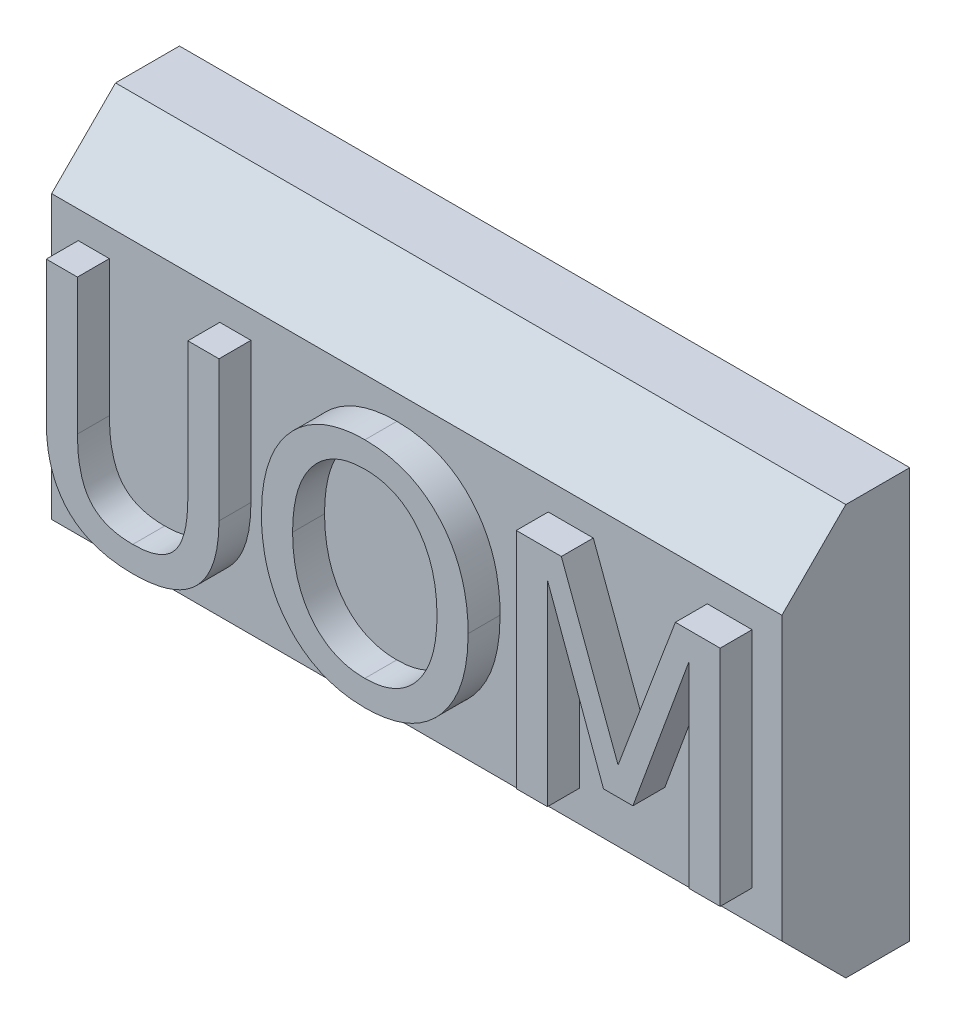
from build123d import *

# Parameters (mm, degrees)
BOSS_EXTRUDE5_DEPTH = 11.427281
BOSS_EXTRUDE6_DEPTH = 0.5


with BuildPart() as part:
    # Sketch6 → Boss-Extrude5 (new body)
    with BuildSketch(Plane(origin=(0, 0, 0), x_dir=(0, 0, -1), z_dir=(1, 0, 0))):
        Polygon((1, 4.929146991), (2, 4.929146991), (2, -1.486632629), (1, -1.486632629), (0, -0.486632629), (0, 3.929146991), align=None)
    extrude(amount=BOSS_EXTRUDE5_DEPTH)

    # Sketch3 → Boss-Extrude6 (add)
    # profile 1 of 3: a face of its own
    with BuildSketch(Plane.XY):
        with BuildLine():
            Line((0.416143204, 3.499962788), (0.903484976, 3.499962788))
            Line((0.903484976, 3.499962788), (0.903484976, 1.371996016))
            add(Edge.make_bspline(
                [(0.903484976, 1.371996016), (0.904227086, 1.326524703), (0.905656325, 1.238950888), (0.914351034, 1.112472094), (0.929908885, 0.995823754), (0.952901435, 0.88903938), (0.980924682, 0.791621238), (1.015086709, 0.703774074), (1.056939832, 0.626271366), (1.104984797, 0.558086727), (1.160610571, 0.498806201), (1.224233651, 0.448193549), (1.295415202, 0.404639357), (1.375404867, 0.37044697), (1.462695851, 0.342558961), (1.558111742, 0.323476327), (1.661242149, 0.312624163), (1.732539226, 0.310954566), (1.769485767, 0.310089371)],
                knots=[0, 0, 0, 0, 1.376819889, 2.651635969, 3.836347594, 4.936722514, 5.955940511, 6.903042086, 7.784610942, 8.616290434, 9.4219432, 10.237023, 11.070988377, 11.94071121, 12.864328567, 13.841290783, 14.88134492, 16, 16, 16, 16], degree=3))
            add(Edge.make_bspline(
                [(1.769485767, 0.310089371), (1.806202381, 0.310952028), (1.877040741, 0.312616375), (1.979473884, 0.323496618), (2.074016457, 0.342434724), (2.160317672, 0.37056602), (2.239557597, 0.404801908), (2.310591352, 0.448180089), (2.374204682, 0.498809996), (2.42983769, 0.558084657), (2.477862395, 0.62627603), (2.519795758, 0.703755997), (2.553648868, 0.791757514), (2.583057817, 0.888807287), (2.604576184, 0.995949131), (2.620568037, 1.112448839), (2.62913327, 1.238957439), (2.630581241, 1.326526942), (2.631333077, 1.371996016)],
                knots=[0, 0, 0, 0, 1.114454679, 2.150147657, 3.122692882, 4.035279244, 4.900768316, 5.736820227, 6.553939311, 7.361607774, 8.195368082, 9.079142573, 10.028613743, 11.052372373, 12.154054081, 13.341729787, 14.619735386, 16, 16, 16, 16], degree=3))
            Line((2.631333077, 1.371996016), (2.631333077, 3.499962788))
            Line((2.631333077, 3.499962788), (3.118674849, 3.499962788))
            Line((3.118674849, 3.499962788), (3.118674849, 1.302771333))
            add(Edge.make_bspline(
                [(3.118674849, 1.302771333), (3.117632966, 1.247119199), (3.115609542, 1.139038072), (3.099395772, 0.982162679), (3.073760625, 0.835658607), (3.03631439, 0.699523534), (2.987830531, 0.574188519), (2.929913308, 0.458712614), (2.859816087, 0.354574755), (2.77943465, 0.260926992), (2.688738665, 0.177698385), (2.587499929, 0.10602186), (2.475912337, 0.045485903), (2.353984334, -0.003248427), (2.222507035, -0.042549241), (2.080438371, -0.068601387), (1.92843276, -0.085798259), (1.82353189, -0.087676906), (1.769485767, -0.088644806)],
                knots=[0, 0, 0, 0, 1.203396059, 2.33709643, 3.407052704, 4.416843994, 5.385341086, 6.309356336, 7.204900642, 8.093184639, 8.972733791, 9.860358641, 10.769263838, 11.711760021, 12.695515199, 13.732034436, 14.831518306, 16, 16, 16, 16], degree=3))
            add(Edge.make_bspline(
                [(1.769485767, -0.088644806), (1.71521014, -0.087673568), (1.609851426, -0.085788222), (1.457142055, -0.068631325), (1.314216014, -0.042395163), (1.181883322, -0.003559879), (1.059492843, 0.045718996), (0.947387007, 0.105755521), (0.846109761, 0.177988639), (0.75466648, 0.26044674), (0.675027309, 0.354825839), (0.605047005, 0.458877246), (0.545964542, 0.573840725), (0.498766704, 0.699718527), (0.460974682, 0.835625191), (0.435446342, 0.982172396), (0.419201909, 1.139035406), (0.417182842, 1.247118293), (0.416143204, 1.302771333)],
                knots=[0, 0, 0, 0, 1.171292133, 2.273687844, 3.313177071, 4.30466322, 5.245410695, 6.15700884, 7.042986791, 7.924584801, 8.807982338, 9.70186505, 10.626436486, 11.59135102, 12.599268744, 13.66723982, 14.798836723, 16, 16, 16, 16], degree=3))
            Line((0.416143204, 1.302771333), (0.416143204, 3.499962788))
        make_face()
    # profile 2 of 3: a face of its own
    with BuildSketch(Plane.XY):
        with BuildLine():
            add(Edge.make_bspline(
                [(5.402397159, 3.544266586), (5.462246122, 3.542948612), (5.579200043, 3.540373092), (5.749821524, 3.516018599), (5.911346929, 3.477588836), (6.063839721, 3.423299268), (6.207501548, 3.35408974), (6.341090707, 3.26794254), (6.465977946, 3.167203043), (6.57950417, 3.050514604), (6.682793918, 2.922216447), (6.772480012, 2.781879471), (6.848877785, 2.63150278), (6.910413596, 2.47007031), (6.959107704, 2.298965057), (6.992313654, 2.116961877), (7.013739577, 1.924922192), (7.016166669, 1.793172801), (7.017409026, 1.725734149)],
                knots=[0, 0, 0, 0, 1.046974495, 2.045946433, 3.009842023, 3.948749427, 4.873574893, 5.794485429, 6.724850033, 7.675874877, 8.638390309, 9.602979465, 10.585554, 11.585350169, 12.622203588, 13.694728314, 14.819998983, 16, 16, 16, 16], degree=3))
            add(Edge.make_bspline(
                [(7.017409026, 1.725734149), (7.016183724, 1.658523681), (7.013794306, 1.527459035), (6.992167411, 1.336142779), (6.959242213, 1.154771949), (6.910243582, 0.9839908), (6.849074922, 0.822869328), (6.772280141, 0.672915871), (6.682784418, 0.532734916), (6.579732711, 0.404417634), (6.465733721, 0.288426434), (6.34111492, 0.187668849), (6.20751823, 0.101465273), (6.063677323, 0.032569648), (5.911610665, -0.023084389), (5.749686437, -0.060093933), (5.579221976, -0.084834545), (5.462253547, -0.087355008), (5.402397159, -0.088644806)],
                knots=[0, 0, 0, 0, 1.177584306, 2.296363576, 3.370365481, 4.404756482, 5.405929662, 6.386251896, 7.352169572, 8.316010668, 9.265464185, 10.197110173, 11.11928907, 12.045388291, 12.986953489, 13.951235703, 14.951583516, 16, 16, 16, 16], degree=3))
            add(Edge.make_bspline(
                [(5.402397159, -0.088644806), (5.342559768, -0.087243888), (5.22565973, -0.084507014), (5.054907212, -0.06132131), (4.893466487, -0.022581169), (4.740913242, 0.031549646), (4.597373281, 0.101113043), (4.463019213, 0.186195092), (4.337474868, 0.286312005), (4.223239698, 0.402297965), (4.119135691, 0.530036826), (4.028797089, 0.669763824), (3.953338421, 0.820478357), (3.890768592, 0.981010653), (3.842305583, 1.152335357), (3.808156093, 1.334197343), (3.786955336, 1.526557072), (3.784492477, 1.65829921), (3.783231811, 1.725734149)],
                knots=[0, 0, 0, 0, 1.046993163, 2.04543576, 3.009348536, 3.94827268, 4.873114636, 5.795280634, 6.726275263, 7.67728276, 8.639205072, 9.605998851, 10.583164017, 11.584437137, 12.617423858, 13.694687211, 14.819977944, 16, 16, 16, 16], degree=3))
            add(Edge.make_bspline(
                [(3.783231811, 1.725734149), (3.784499678, 1.793167465), (3.786976606, 1.924906431), (3.808052274, 2.117063164), (3.842532146, 2.298844092), (3.890587304, 2.4702857), (3.953548456, 2.63111657), (4.028558923, 2.782292585), (4.119360297, 2.922184769), (4.223197774, 3.050551981), (4.337458654, 3.167215801), (4.463016032, 3.267978548), (4.597174521, 3.353910321), (4.740938987, 3.42332509), (4.893451716, 3.477581678), (5.054971582, 3.516020604), (5.2255946, 3.540372555), (5.342548306, 3.54294843), (5.402397159, 3.544266586)],
                knots=[0, 0, 0, 0, 1.178933409, 2.303185988, 3.375492215, 4.41140754, 5.41175692, 6.391624662, 7.35752651, 8.321699006, 9.274695168, 10.207356909, 11.130834481, 12.05482321, 12.992881136, 13.95590464, 14.953972757, 16, 16, 16, 16], degree=3))
        make_face()
        with BuildLine():
            add(Edge.make_bspline(
                [(5.400320419, 3.145532409), (5.35803641, 3.14427069), (5.27541253, 3.141805264), (5.154622477, 3.124415503), (5.040796804, 3.094770228), (4.933403863, 3.052757792), (4.833088358, 2.998703881), (4.739097158, 2.932857447), (4.652403926, 2.854815258), (4.572869424, 2.765379259), (4.501719741, 2.665767382), (4.440079646, 2.55698884), (4.386908752, 2.439945508), (4.344436085, 2.313670722), (4.311169081, 2.178899707), (4.288130717, 2.035568821), (4.273106925, 1.883655163), (4.271432966, 1.779305484), (4.270573583, 1.725734149)],
                knots=[0, 0, 0, 0, 0.992078402, 1.938542973, 2.856561574, 3.746427499, 4.637939252, 5.524223217, 6.432997522, 7.368745408, 8.327383014, 9.299866671, 10.29827865, 11.339356729, 12.421474065, 13.551982278, 14.743229712, 16, 16, 16, 16], degree=3))
            add(Edge.make_bspline(
                [(4.270573583, 1.725734149), (4.271435175, 1.672623784), (4.273116806, 1.568964413), (4.288197128, 1.417753347), (4.311085619, 1.274857783), (4.344420664, 1.140549714), (4.387052766, 1.014803381), (4.440069416, 0.897940197), (4.501709798, 0.789146996), (4.57291796, 0.689609896), (4.652124511, 0.600014393), (4.739595317, 0.522951233), (4.832626534, 0.455951117), (4.933648368, 0.403070886), (5.040757185, 0.360783207), (5.154633534, 0.33122535), (5.275409573, 0.313811414), (5.358035409, 0.311349362), (5.400320419, 0.310089371)],
                knots=[0, 0, 0, 0, 1.248257537, 2.436315255, 3.568920878, 4.647780726, 5.68565685, 6.685921162, 7.660209049, 8.620625195, 9.558109156, 10.4649585, 11.356013141, 12.24662183, 13.138138705, 14.057860487, 15.006081015, 16, 16, 16, 16], degree=3))
            add(Edge.make_bspline(
                [(5.400320419, 0.310089371), (5.442604788, 0.311350447), (5.525229374, 0.313814618), (5.646014372, 0.331213368), (5.759858322, 0.36082614), (5.866893881, 0.402841381), (5.967484462, 0.456415555), (6.060976588, 0.522453192), (6.147787085, 0.600316817), (6.227118702, 0.689535237), (6.298104952, 0.789362494), (6.360719863, 0.897721104), (6.413532899, 1.014835582), (6.45623582, 1.140540581), (6.48955073, 1.274860403), (6.512444996, 1.417752597), (6.527523684, 1.568964615), (6.529205545, 1.672623853), (6.530067254, 1.725734149)],
                knots=[0, 0, 0, 0, 0.994024979, 1.942346626, 2.862166489, 3.753778437, 4.639694184, 5.535275203, 6.438171751, 7.375755687, 8.336274254, 9.313365839, 10.313736821, 11.351723626, 12.430698526, 13.563424932, 14.751609347, 16, 16, 16, 16], degree=3))
            add(Edge.make_bspline(
                [(6.530067254, 1.725734149), (6.529207753, 1.779305414), (6.527533561, 1.883654958), (6.512511413, 2.035569575), (6.489467259, 2.178897083), (6.456220518, 2.313679923), (6.41367661, 2.439913134), (6.360709572, 2.557207896), (6.298094939, 2.665551865), (6.22716738, 2.76545382), (6.147506692, 2.854513751), (6.061474862, 2.933355261), (5.967022545, 2.998239032), (5.867139571, 3.052987268), (5.759818468, 3.094727141), (5.646025495, 3.124427529), (5.525226399, 3.141802048), (5.442603781, 3.144269602), (5.400320419, 3.145532409)],
                knots=[0, 0, 0, 0, 1.256900501, 2.448271359, 3.578896704, 4.661126157, 5.702312102, 6.700827525, 7.676106732, 8.634843661, 9.5706885, 10.475531073, 11.366345495, 12.253184336, 13.14314246, 14.061256176, 15.007818809, 16, 16, 16, 16], degree=3))
        make_face(mode=Mode.SUBTRACT)
    # profile 3 of 3: a face of its own
    with BuildSketch(Plane.XY):
        Polygon((7.770573583, 3.499962788), (8.475973109, 3.499962788), (9.363433552, 1.116556934), (10.259893204, 3.499962788), (10.960447001, 3.499962788), (10.960447001, -3.7212e-05), (10.473105229, -3.7212e-05), (10.473105229, 3.072846491), (9.595336242, 0.680441428), (9.135684343, 0.680441428), (8.257915355, 3.072846491), (8.257915355, -3.7212e-05), (7.770573583, -3.7212e-05), align=None)
    extrude(amount=BOSS_EXTRUDE6_DEPTH)


solid = part.part
